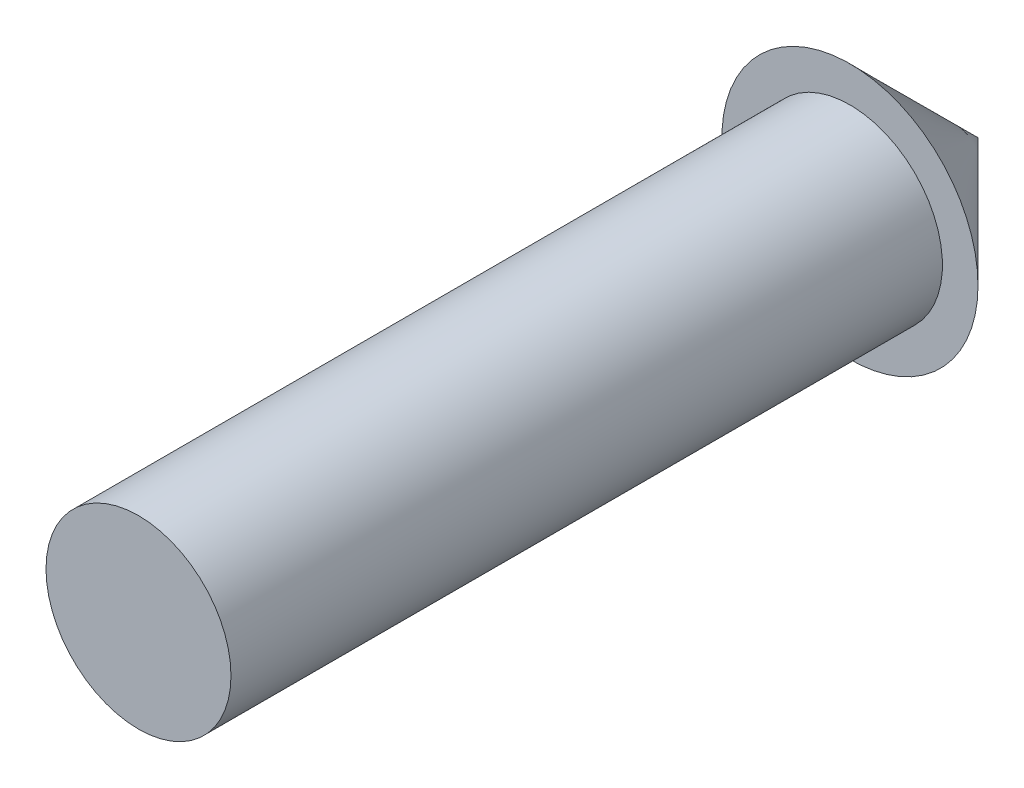
from build123d import *

# Parameters (mm, degrees)
SKETCH3_R      = 13
EXTRUDE2_DEPTH = 100


with BuildPart() as part:
    # Sketch2 → Revolve1 (revolve)
    with BuildSketch(Plane(origin=(0, 0, 0), x_dir=(1, 0, 0), z_dir=(0, 1, 0)), mode=Mode.PRIVATE) as revolve1_sk:
        Polygon((-18, 0), (0, 0), (0, 18), align=None)
    revolve(revolve1_sk.sketch.rotate(Axis((0, 0, 0), (0, 0, -1)), 180), axis=Axis((0, 0, 0), (0, 0, -1)))

    # Sketch3 → Extrude2 (add)
    with BuildSketch(Plane.XY):
        with Locations(Location((0, 0, 0), (0, 0, 180))):
            Circle(SKETCH3_R)
    extrude(amount=EXTRUDE2_DEPTH)


solid = part.part
